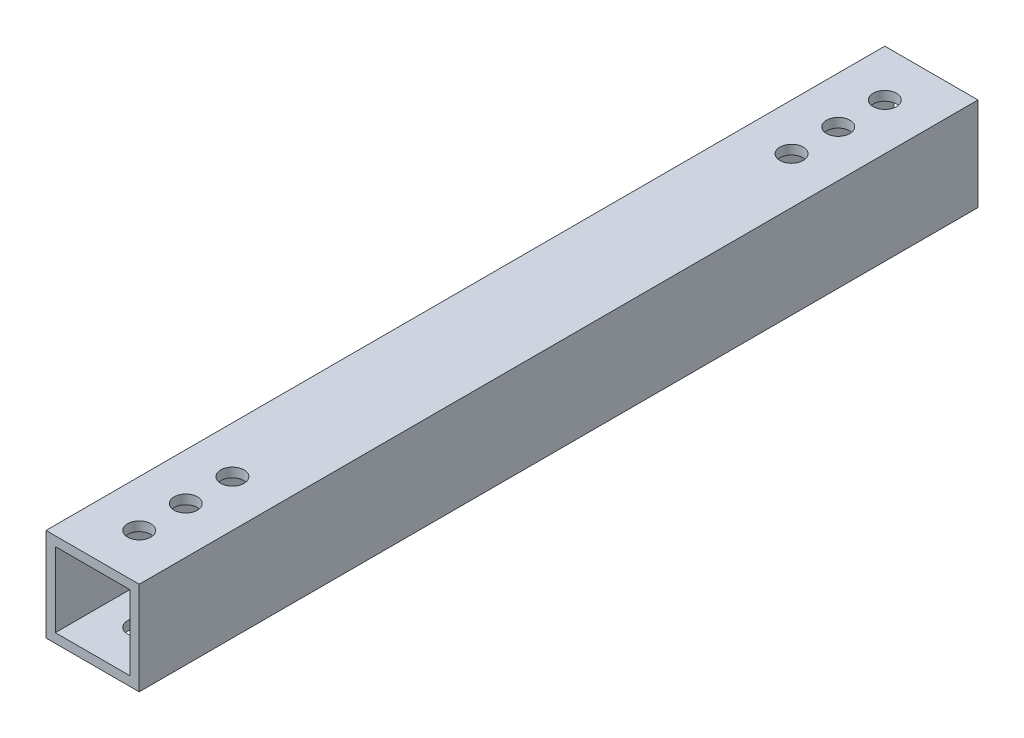
from build123d import *

# Parameters (mm, degrees)
SKETCH1_W           = 25.4
SKETCH1_H           = 25.4
SKETCH1_W_2         = 20.32
SKETCH1_H_2         = 20.32
BOSS_EXTRUDE2_DEPTH = 228.6
SKETCH3_R           = 3.175
CUT_EXTRUDE2_DEPTH  = 231.35713577


with BuildPart() as part:
    # Sketch1 → Boss-Extrude2 (new body)
    with BuildSketch(Plane.XY):
        Rectangle(SKETCH1_W, SKETCH1_H)
        Rectangle(SKETCH1_W_2, SKETCH1_H_2, mode=Mode.SUBTRACT)
    extrude(amount=BOSS_EXTRUDE2_DEPTH)

    # Sketch3 → Cut-Extrude2 (cut, through all)
    with BuildSketch(Plane(origin=(0, 12.7, 0), x_dir=(1, 0, 0), z_dir=(0, 1, 0))):
        with Locations(Location((0, -12.7, 0), (0, 0, 270))):
            Circle(SKETCH3_R)
        with Locations(Location((0, -25.4, 0), (0, 0, 270))):
            Circle(SKETCH3_R)
        with Locations(Location((0, -38.1, 0), (0, 0, 270))):
            Circle(SKETCH3_R)
        with Locations((0, -190.5)):
            Circle(SKETCH3_R)
        with Locations((0, -203.2)):
            Circle(SKETCH3_R)
        with Locations((0, -215.9)):
            Circle(SKETCH3_R)
    extrude(amount=-CUT_EXTRUDE2_DEPTH, mode=Mode.SUBTRACT)


solid = part.part
